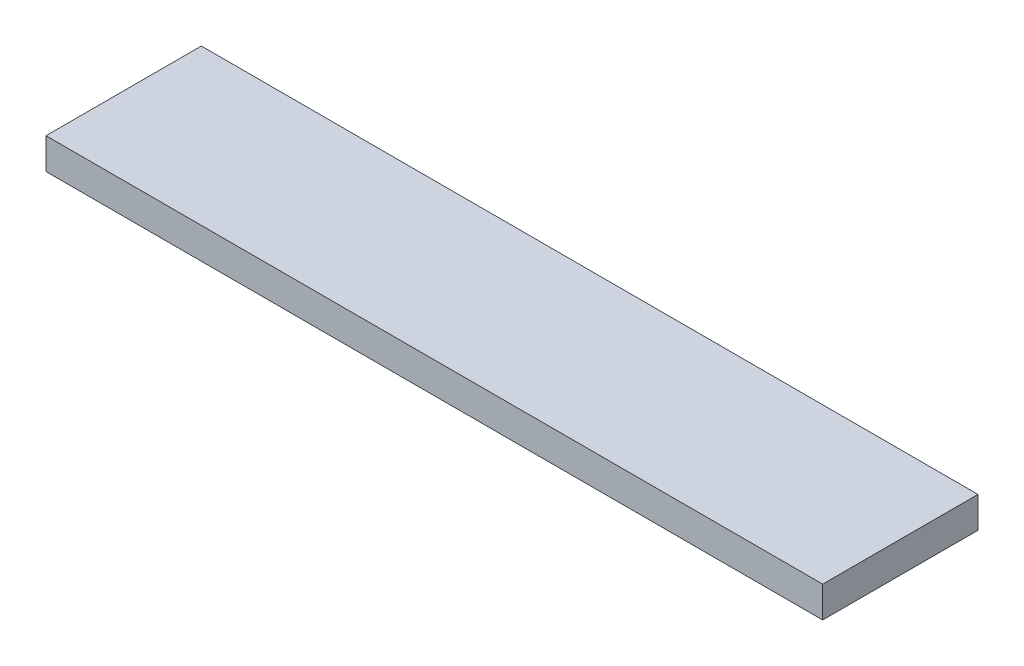
from build123d import *

# Parameters (mm, degrees)
ESQUISSE1_W        = 50
ESQUISSE1_H        = 2
BOSS_EXTRU_1_DEPTH = 10


with BuildPart() as part:
    # Esquisse1 → Boss.-Extru.1 (new body)
    with BuildSketch(Plane.XY):
        Rectangle(ESQUISSE1_W, ESQUISSE1_H)
    extrude(amount=BOSS_EXTRU_1_DEPTH)


solid = part.part
